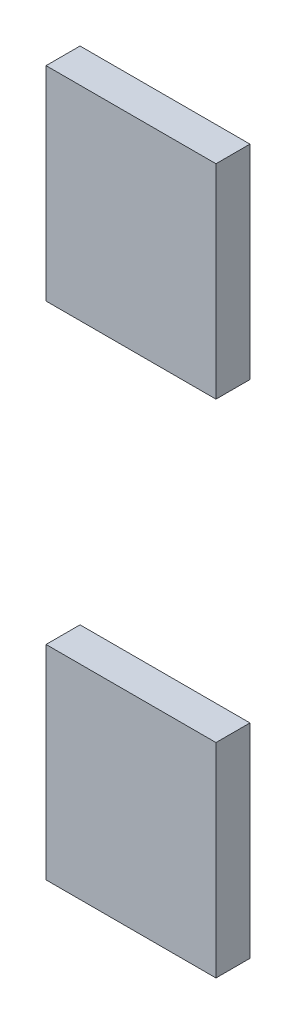
from build123d import *

# Parameters (mm, degrees)
BODY_W               = 5
BODY_H               = 6
BODY_EXTRUDE_DEPTH   = 1
BODY_EXTRUDE_2_DEPTH = 1


with BuildPart() as part:
    # BODY → Body Extrude (new body)
    with BuildSketch(Plane.XY):
        with Locations((-7, 7.375)):
            Rectangle(BODY_W, BODY_H)
    extrude(amount=BODY_EXTRUDE_DEPTH)


with BuildPart() as body_2:
    # BODY → Body Extrude 2 (new body)
    with BuildSketch(Plane.XY):
        with Locations((-7, -7.375)):
            Rectangle(BODY_W, BODY_H)
    extrude(amount=BODY_EXTRUDE_2_DEPTH)


solid = Compound([part.part, body_2.part])
